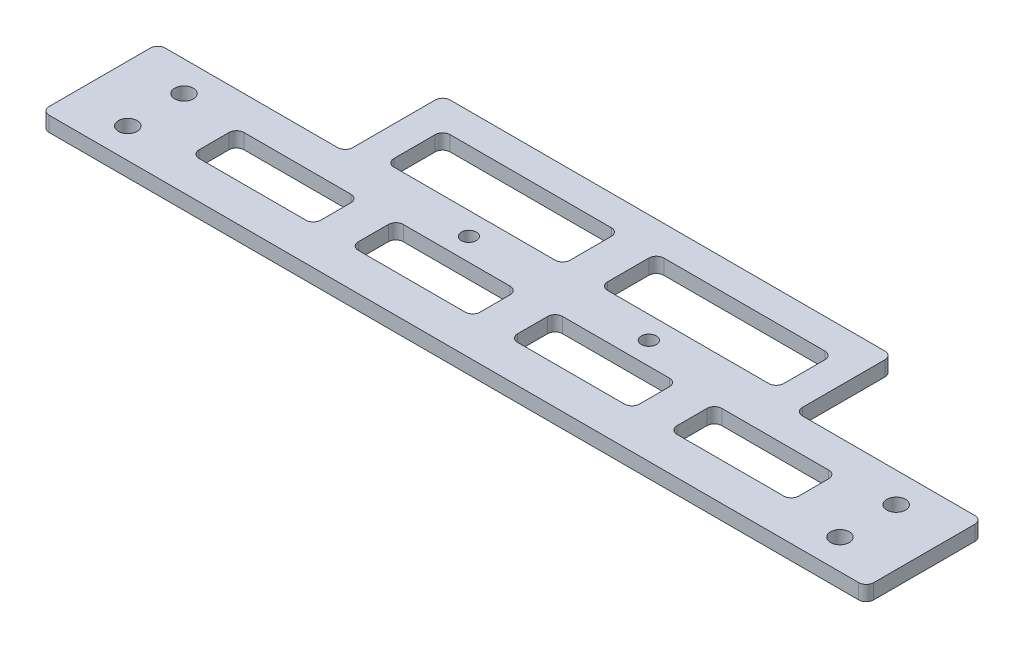
from build123d import *

# Parameters (mm, degrees)
SKETCH_1_R          = 1.25
SKETCH_1_R_2        = 1
EXTRUDE_1_DEPTH     = 2
SKETCH_2_W          = 16.25
SKETCH_2_H          = 6
SKETCH_2_W_2        = 23.5
SKETCH_2_H_2        = 7.5
CUT_EXTRUDE_1_DEPTH = 59.8180457
FILLET_1_R          = 1


with BuildPart() as part:
    # 草图1 → 凸台-拉伸1 (new body)
    with BuildSketch(Plane(origin=(0, 0, 0), x_dir=(1, 0, 0), z_dir=(0, 1, 0))):
        Polygon((30, 7.75), (55, 7.75), (55, -7.75), (-55, -7.75), (-55, 7.75), (-30, 7.75), (-30, 20.75), (30, 20.75), align=None)
        with Locations(Location((-47.5, 3.75, 0), (0, 0, 270))):
            Circle(SKETCH_1_R, mode=Mode.SUBTRACT)
        with Locations(Location((-47.5, -3.75, 0), (0, 0, 270))):
            Circle(SKETCH_1_R, mode=Mode.SUBTRACT)
        with Locations(Location((47.5, 3.75, 0), (0, 0, 270))):
            Circle(SKETCH_1_R, mode=Mode.SUBTRACT)
        with Locations(Location((47.5, -3.75, 0), (0, 0, 270))):
            Circle(SKETCH_1_R, mode=Mode.SUBTRACT)
        with Locations(Location((-12, 6.25, 0), (0, 0, 270))):
            Circle(SKETCH_1_R_2, mode=Mode.SUBTRACT)
        with Locations(Location((12, 6.25, 0), (0, 0, 270))):
            Circle(SKETCH_1_R_2, mode=Mode.SUBTRACT)
    extrude(amount=EXTRUDE_1_DEPTH)

    # 草图2 → 切除-拉伸1 (cut, through all)
    with BuildSketch(Plane(origin=(0, 2, 0), x_dir=(1, 0, 0), z_dir=(0, 1, 0))):
        with Locations((-31.875, 0.25)):
            Rectangle(SKETCH_2_W, SKETCH_2_H)
        with Locations((-10.625, 0.25)):
            Rectangle(SKETCH_2_W, SKETCH_2_H)
        with Locations((10.625, 0.25)):
            Rectangle(SKETCH_2_W, SKETCH_2_H)
        with Locations((31.875, 0.25)):
            Rectangle(SKETCH_2_W, SKETCH_2_H)
        with Locations((-14.25, 13)):
            Rectangle(SKETCH_2_W_2, SKETCH_2_H_2)
        with Locations((14.25, 13)):
            Rectangle(SKETCH_2_W_2, SKETCH_2_H_2)
    extrude(amount=-CUT_EXTRUDE_1_DEPTH, mode=Mode.SUBTRACT)

    # 圆角1
    fillet_1_edges = [part.edges().sort_by_distance(p)[0] for p in [
        (-40, 1, 2.75),
        (-40, 1, -3.25),
        (-23.75, 1, -3.25),
        (-23.75, 1, 2.75),
        (-55, 1, -7.75),
        (-30, 1, -7.75),
        (-30, 1, -20.75),
        (30, 1, -20.75),
        (30, 1, -7.75),
        (55, 1, -7.75),
        (55, 1, 7.75),
        (-55, 1, 7.75),
        (40, 1, 2.75),
        (23.75, 1, 2.75),
        (23.75, 1, -3.25),
        (40, 1, -3.25),
        (-26, 1, -9.25),
        (-26, 1, -16.75),
        (-2.5, 1, -16.75),
        (-2.5, 1, -9.25),
        (2.5, 1, -16.75),
        (26, 1, -16.75),
        (26, 1, -9.25),
        (2.5, 1, -9.25),
        (-18.75, 1, 2.75),
        (-18.75, 1, -3.25),
        (-2.5, 1, -3.25),
        (-2.5, 1, 2.75),
        (18.75, 1, -3.25),
        (18.75, 1, 2.75),
        (2.5, 1, 2.75),
        (2.5, 1, -3.25),
    ]]
    fillet(fillet_1_edges, radius=FILLET_1_R)


solid = part.part
